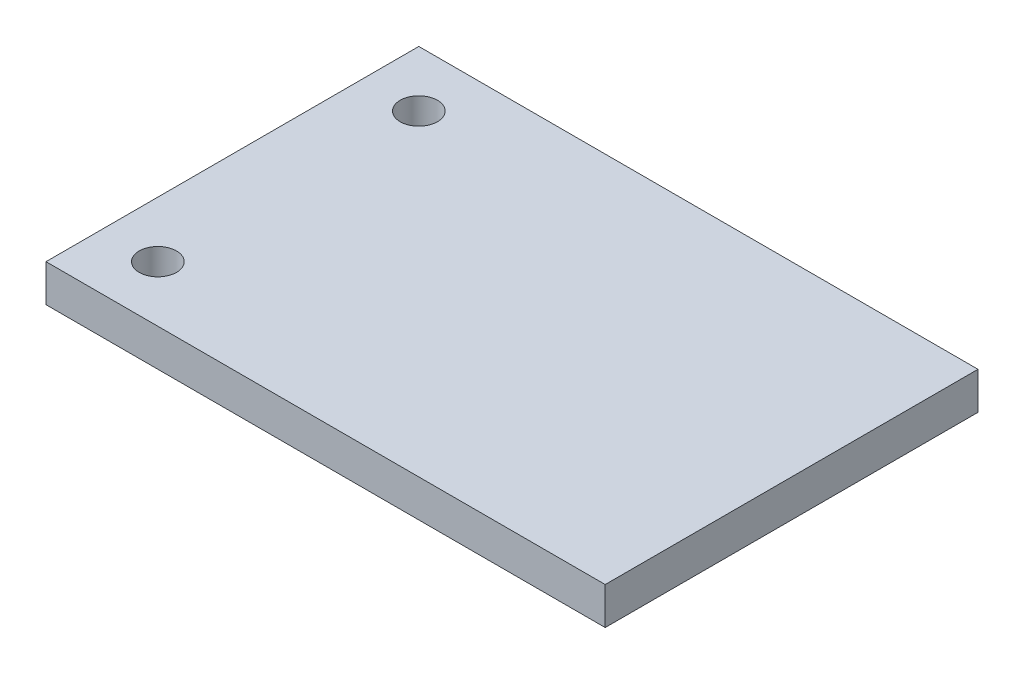
from build123d import *

# Parameters (mm, degrees)
SZKIC1_W                    = 300
SZKIC1_H                    = 200
SZKIC1_R                    = 10
DODANIE_WYCI_GNI_CIE1_DEPTH = 20


with BuildPart() as part:
    # Szkic1 → Dodanie-wyciągnięcie1 (new body)
    with BuildSketch(Plane(origin=(0, 0, 0), x_dir=(1, 0, 0), z_dir=(0, 1, 0))):
        with Locations((150, 100)):
            Rectangle(SZKIC1_W, SZKIC1_H)
        with Locations(Location((30, 30, 0), (0, 0, 270))):
            Circle(SZKIC1_R, mode=Mode.SUBTRACT)
        with Locations(Location((30, 170, 0), (0, 0, 270))):
            Circle(SZKIC1_R, mode=Mode.SUBTRACT)
    extrude(amount=DODANIE_WYCI_GNI_CIE1_DEPTH)


solid = part.part
